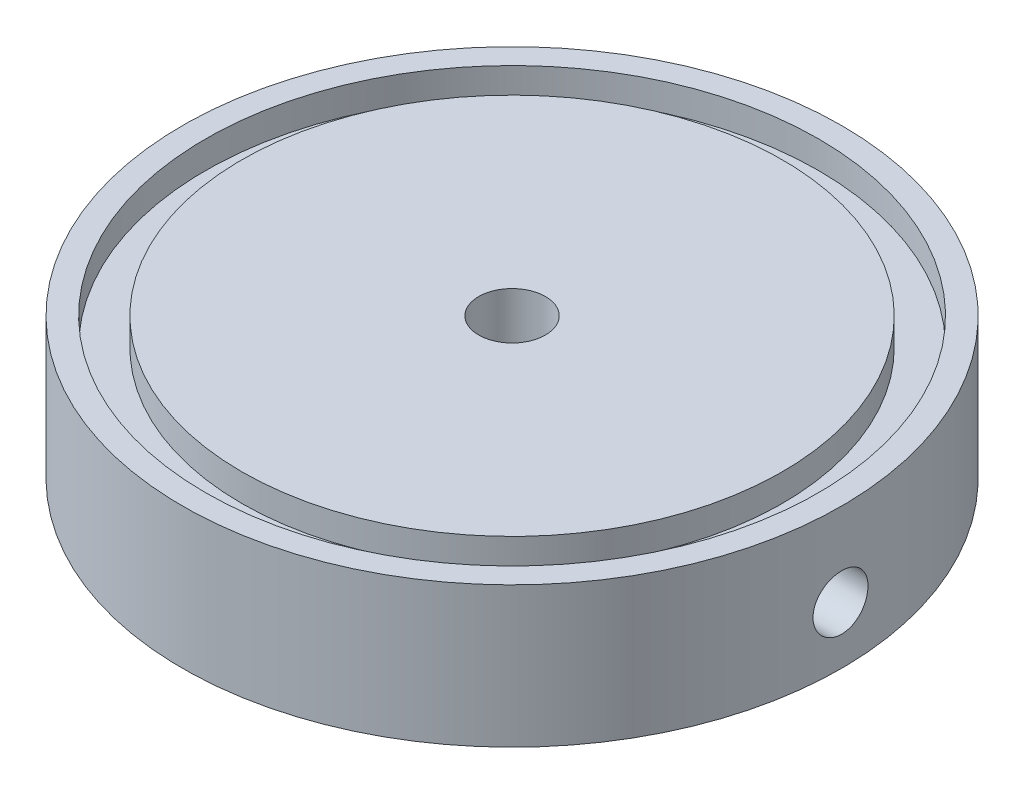
from build123d import *

# Parameters (mm, degrees)
SKETCH2_R          = 1.7272
CUT_EXTRUDE1_DEPTH = 55.61
SKETCH3_R          = 35.433
SKETCH3_R_2        = 31.242
CUT_EXTRUDE2_DEPTH = 3.175
SKETCH4_R          = 1.03251
CUT_EXTRUDE3_DEPTH = 3.175
CIRPATTERN1_COUNT  = 9
SKETCH5_R          = 3.175
CUT_EXTRUDE4_DEPTH = 9.525


with BuildPart() as part:
    # Sketch1 → Revolve1 (revolve)
    with BuildSketch(Plane.XY):
        with BuildLine():
            Line((3.8608, 7.366), (38.1, 7.366))
            Line((38.1, 7.366), (38.1, -8.89))
            Line((38.1, -8.89), (22.6695, -8.89))
            Line((22.6695, -8.89), (22.6695, -7.874))
            Line((22.6695, -7.874), (21.1455, -7.874))
            Line((21.1455, -7.874), (21.1455, -8.89))
            Line((21.1455, -8.89), (10.9855, -8.89))
            Line((10.9855, -8.89), (10.9855, -6.391948453))
            ThreePointArc((10.9855, -6.391948453), (10.570616467, -5.000733157), (9.4615, -4.064))
            Line((9.4615, -4.064), (3.8608, 0))
            Line((3.8608, 0), (3.8608, 7.366))
        make_face()
    revolve(axis=Axis((0, 101.60464546, 0), (0, 1, 0)))

    # Sketch2 → Cut-Extrude1 (cut, through all)
    with BuildSketch(Plane(origin=(0, 0, 0), x_dir=(0, 0, -1), z_dir=(1, 0, 0))):
        with Locations((0, -2.286)):
            Circle(SKETCH2_R)
    extrude(amount=CUT_EXTRUDE1_DEPTH, mode=Mode.SUBTRACT)

    # Sketch3 → Cut-Extrude2 (cut)
    with BuildSketch(Plane(origin=(0, 7.366, 0), x_dir=(1, 0, 0), z_dir=(0, 1, 0))):
        Circle(SKETCH3_R)
        Circle(SKETCH3_R_2, mode=Mode.SUBTRACT)
    extrude(amount=-CUT_EXTRUDE2_DEPTH, mode=Mode.SUBTRACT)

    # Sketch4 → Cut-Extrude3 (cut)
    with BuildSketch(Plane(origin=(0, -8.89, 0), x_dir=(-1, 0, 0), z_dir=(0, -1, 0))):
        with Locations((-13.97, 24.196749782)):
            Circle(SKETCH4_R)
    cut_extrude3 = extrude(amount=-CUT_EXTRUDE3_DEPTH, mode=Mode.SUBTRACT)

    # CirPattern1: Cut-Extrude3 ×9 about axis
    cirpattern1_axis = Axis((0, 7.366, 0), (0, -1, 0))
    for i in range(1, CIRPATTERN1_COUNT):
        add(cut_extrude3.rotate(cirpattern1_axis, i * 360 / CIRPATTERN1_COUNT), mode=Mode.SUBTRACT)

    # Sketch5 → Cut-Extrude4 (cut)
    with BuildSketch(Plane(origin=(38.1, 0, 0), x_dir=(0, 0, -1), z_dir=(1, 0, 0))):
        with Locations((0, -2.286)):
            Circle(SKETCH5_R)
    extrude(amount=-CUT_EXTRUDE4_DEPTH, mode=Mode.SUBTRACT)


solid = part.part
